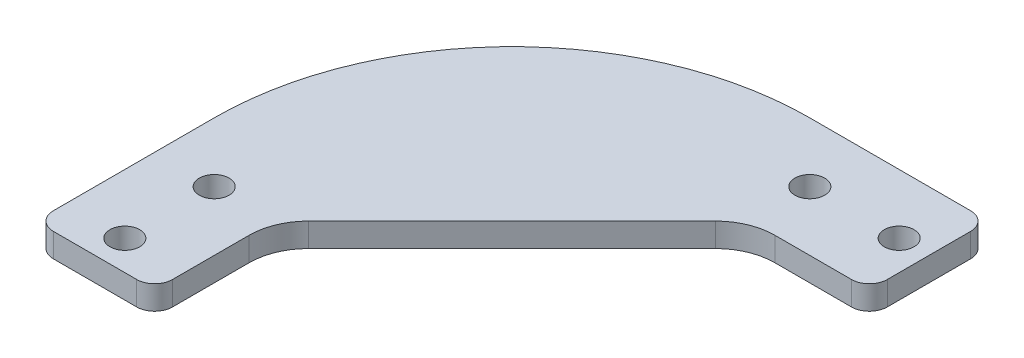
from build123d import *

# Parameters (mm, degrees)
SKETCH1_R           = 2.5
BOSS_EXTRUDE1_DEPTH = 4


with BuildPart() as part:
    # Sketch1 → Boss-Extrude1 (new body)
    with BuildSketch(Plane(origin=(0, 0, 0), x_dir=(1, 0, 0), z_dir=(0, 1, 0))):
        with BuildLine():
            Line((-50, 0), (-50, -27))
            ThreePointArc((-50, -27), (-49.121320344, -29.121320344), (-47, -30))
            Line((-47, -30), (-33, -30))
            ThreePointArc((-33, -30), (-30.878679656, -29.121320344), (-30, -27))
            Line((-30, -27), (-30, -14.142135624))
            ThreePointArc((-30, -14.142135624), (-29.238795325, -10.3153013), (-27.071067812, -7.071067812))
            Line((-27.071067812, -7.071067812), (7.071067812, 27.071067812))
            ThreePointArc((7.071067812, 27.071067812), (10.3153013, 29.238795325), (14.142135624, 30))
            Line((14.142135624, 30), (27, 30))
            ThreePointArc((27, 30), (29.121320344, 30.878679656), (30, 33))
            Line((30, 33), (30, 47))
            ThreePointArc((30, 47), (29.121320344, 49.121320344), (27, 50))
            Line((27, 50), (0, 50))
            ThreePointArc((0, 50), (-35.355339059, 35.355339059), (-50, 0))
        make_face()
        with Locations(Location((-40, -10, 0), (0, 0, 270))):
            Circle(SKETCH1_R, mode=Mode.SUBTRACT)
        with Locations(Location((-40, -25, 0), (0, 0, 270))):
            Circle(SKETCH1_R, mode=Mode.SUBTRACT)
        with Locations(Location((10, 40, 0), (0, 0, 270))):
            Circle(SKETCH1_R, mode=Mode.SUBTRACT)
        with Locations(Location((25, 40, 0), (0, 0, 270))):
            Circle(SKETCH1_R, mode=Mode.SUBTRACT)
    extrude(amount=BOSS_EXTRUDE1_DEPTH)


solid = part.part
